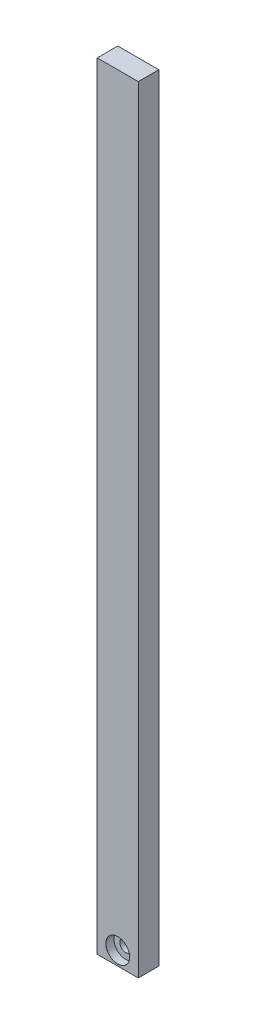
from build123d import *

# Parameters (mm, degrees)
ESBO_O1_W                = 19.05
ESBO_O1_H                = 360
RESSALTO_EXTRUS_O1_DEPTH = 9.525
ESBO_O3_R                = 2.5
CORTE_EXTRUS_O1_DEPTH    = 181.503327532


with BuildPart() as part:
    # Esboço1 → Ressalto-extrusão1 (new body)
    with BuildSketch(Plane.XY):
        Rectangle(ESBO_O1_W, ESBO_O1_H)
    extrude(amount=RESSALTO_EXTRUS_O1_DEPTH)

    # Esboço3 → Corte-extrusão1 (cut, through all)
    with BuildSketch(Plane.XY.offset(9.525)):
        with Locations((0, -173.65)):
            Circle(ESBO_O3_R)
    extrude(amount=-CORTE_EXTRUS_O1_DEPTH, mode=Mode.SUBTRACT)

    # Esboço5 → Rebaixo para parafuso com cabeça panela de M51 (revolve, cut)
    with BuildSketch(Plane(origin=(0, -173.65, 9.525), x_dir=(0, -1, 0), z_dir=(1, 0, 0))):
        Polygon((0, 0), (0, 9.525), (2.75, 9.525), (2.75, 3.7), (5.5, 3.7), (5.5, 0.025), (5.525, 0), align=None)
    revolve(axis=Axis((0, -173.65, 15.875), (0, 0, -1)), mode=Mode.SUBTRACT)


solid = part.part
